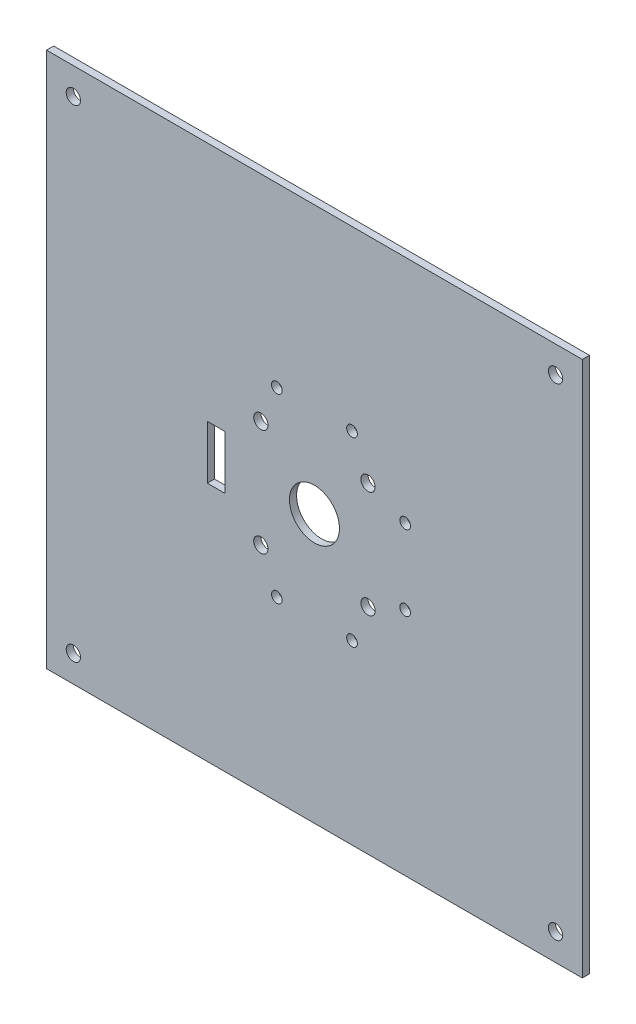
from build123d import *

# Parameters (mm, degrees)
CROQUIS1_W              = 150
CROQUIS1_H              = 150
SALIENTE_EXTRUIR1_DEPTH = 2
CROQUIS2_R              = 2
CROQUIS2_R_2            = 7
CROQUIS2_R_3            = 1.5
CROQUIS2_W              = 5
CROQUIS2_H              = 15
CORTAR_EXTRUIR1_DEPTH   = 2


with BuildPart() as part:
    # Croquis1 → Saliente-Extruir1 (new body)
    with BuildSketch(Plane.XY):
        Rectangle(CROQUIS1_W, CROQUIS1_H)
    extrude(amount=SALIENTE_EXTRUIR1_DEPTH)

    # Croquis2 → Cortar-Extruir1 (cut)
    with BuildSketch(Plane.XY.offset(2)):
        with Locations((-67.5, -67.5)):
            Circle(CROQUIS2_R)
        with Locations((67.5, -67.5)):
            Circle(CROQUIS2_R)
        with Locations((67.5, 67.5)):
            Circle(CROQUIS2_R)
        with Locations((-67.5, 67.5)):
            Circle(CROQUIS2_R)
        Circle(CROQUIS2_R_2)
        with Locations((-15, -15)):
            Circle(CROQUIS2_R)
        with Locations((15, -15)):
            Circle(CROQUIS2_R)
        with Locations((15, 15)):
            Circle(CROQUIS2_R)
        with Locations((-15, 15)):
            Circle(CROQUIS2_R)
        with Locations((-10.52379439, 25.406687144)):
            Circle(CROQUIS2_R_3)
        with Locations((10.52379439, 25.406687144)):
            Circle(CROQUIS2_R_3)
        with Locations((25.406687144, 10.52379439)):
            Circle(CROQUIS2_R_3)
        with Locations((25.406687144, -10.52379439)):
            Circle(CROQUIS2_R_3)
        with Locations((10.52379439, -25.406687144)):
            Circle(CROQUIS2_R_3)
        with Locations((-10.52379439, -25.406687144)):
            Circle(CROQUIS2_R_3)
        with Locations((-27.5, 0)):
            Rectangle(CROQUIS2_W, CROQUIS2_H)
    extrude(amount=-CORTAR_EXTRUIR1_DEPTH, mode=Mode.SUBTRACT)


solid = part.part
